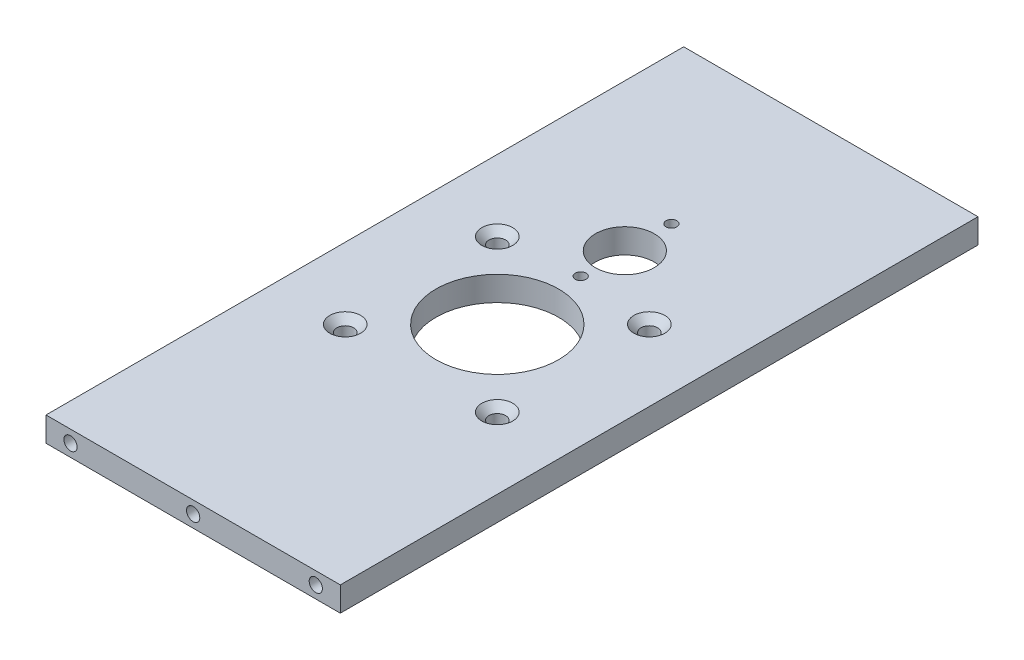
from build123d import *

# Parameters (mm, degrees)
SKETCH_1_W                   = 60
SKETCH_1_H                   = 130
EXTRUDE_1_DEPTH              = 5
HOLE_WIZARD_M3_1_D           = 3.4
HOLE_WIZARD_M3_1_DEPTH       = 7.5
HOLE_WIZARD_M3_1_CSINK_D     = 6.3
HOLE_WIZARD_M3_1_CSINK_ANGLE = 90
HOLE_WIZARD_M3_1_TIP         = 1.021463052
SKETCH_6_R                   = 12.5
CUT_EXTRUDE_1_DEPTH          = 72.763500472
F_1_0MM_2_AT_2_COUNT         = 2
F_1_0MM_2_AT_2_PITCH         = 25
F_1_0MM_2_AT_3_COUNT         = 2
F_1_0MM_2_AT_3_PITCH         = 50
F_1_0MM_1_D                  = 2.2
SKETCH_13_R                  = 6
CUT_EXTRUDE_2_DEPTH          = 72.763500472


with BuildPart() as part:
    # 草圖1 → 填料-伸長1 (new body)
    with BuildSketch(Plane(origin=(0, 0, 0), x_dir=(1, 0, 0), z_dir=(0, 1, 0))):
        Rectangle(SKETCH_1_W, SKETCH_1_H)
    extrude(amount=EXTRUDE_1_DEPTH)

    # M3 錐坑平頭螺釘的錐孔1
    with Locations(Plane(origin=(0, 5, 0), x_dir=(1, 0, 0), z_dir=(0, 1, 0))):
        with Locations((-15.5, 12.5), (-15.5, -18.5), (15.5, 12.5), (15.5, -18.5)):
            CounterSinkHole(HOLE_WIZARD_M3_1_D / 2, HOLE_WIZARD_M3_1_CSINK_D / 2, depth=HOLE_WIZARD_M3_1_DEPTH, counter_sink_angle=HOLE_WIZARD_M3_1_CSINK_ANGLE)
            with Locations((0, 0, -(HOLE_WIZARD_M3_1_DEPTH + HOLE_WIZARD_M3_1_TIP / 2))):  # 118° drill point
                Cone(0, HOLE_WIZARD_M3_1_D / 2, HOLE_WIZARD_M3_1_TIP, mode=Mode.SUBTRACT)

    # 草圖6 → 除料-伸長1 (cut, through all)
    with BuildSketch(Plane(origin=(0, 5, 0), x_dir=(1, 0, 0), z_dir=(0, 1, 0))):
        with Locations(Location((0, -3, 0), (0, 0, 270))):
            Circle(SKETCH_6_R)
    extrude(amount=-CUT_EXTRUDE_1_DEPTH, mode=Mode.SUBTRACT)

    # 草圖8 → Ø1.0mm 定位孔2 (revolve, cut)
    with BuildSketch(Plane(origin=(25, 2.5, -65), x_dir=(0, 1, 0), z_dir=(1, 0, 0))):
        Polygon((0, 0), (0, 8.311161836), (1.35, 7.5), (1.35, 0), align=None)
    f_1_0mm_2 = revolve(axis=Axis((25, 2.5, -71.35), (0, 0, 1)), mode=Mode.SUBTRACT)

    # Ø1.0mm 定位孔2 at 2: Ø1.0mm 定位孔2 ×2
    with Locations(*[(-i * F_1_0MM_2_AT_2_PITCH, 0, 0) for i in range(1, F_1_0MM_2_AT_2_COUNT)]):
        add(f_1_0mm_2, mode=Mode.SUBTRACT)

    # Ø1.0mm 定位孔2 at 3: Ø1.0mm 定位孔2 ×2
    with Locations(*[(-i * F_1_0MM_2_AT_3_PITCH, 0, 0) for i in range(1, F_1_0MM_2_AT_3_COUNT)]):
        add(f_1_0mm_2, mode=Mode.SUBTRACT)

    # 鏡射1: Ø1.0mm 定位孔2 across plane
    add(f_1_0mm_2.mirror(Plane.XY), mode=Mode.SUBTRACT)

    # 鏡射1 copy 1 sketch → 鏡射1 copy 1 (revolve, cut)
    with BuildSketch(Plane(origin=(0, 2.5, 65), x_dir=(0, 1, 0), z_dir=(1, 0, 0))):
        Polygon((0, 0), (0, -8.311161836), (1.35, -7.5), (1.35, 0), align=None)
    revolve(axis=Axis((0, 2.5, 71.35), (0, 0, 1)), mode=Mode.SUBTRACT)

    # 鏡射1 copy 2 sketch → 鏡射1 copy 2 (revolve, cut)
    with BuildSketch(Plane(origin=(-25, 2.5, 65), x_dir=(0, 1, 0), z_dir=(1, 0, 0))):
        Polygon((0, 0), (0, -8.311161836), (1.35, -7.5), (1.35, 0), align=None)
    revolve(axis=Axis((-25, 2.5, 71.35), (0, 0, 1)), mode=Mode.SUBTRACT)

    # Ø1.0mm 定位孔1 (through all)
    with Locations(Plane(origin=(0, 5, 0), x_dir=(1, 0, 0), z_dir=(0, 1, 0))):
        with Locations((0, 32.5), (0, 14)):
            Hole(F_1_0MM_1_D / 2)

    # 草圖13 → 除料-伸長2 (cut, through all)
    with BuildSketch(Plane(origin=(0, 5, 0), x_dir=(1, 0, 0), z_dir=(0, 1, 0))):
        with Locations(Location((0, 23, 0), (0, 0, 270))):
            Circle(SKETCH_13_R)
    extrude(amount=-CUT_EXTRUDE_2_DEPTH, mode=Mode.SUBTRACT)


solid = part.part
